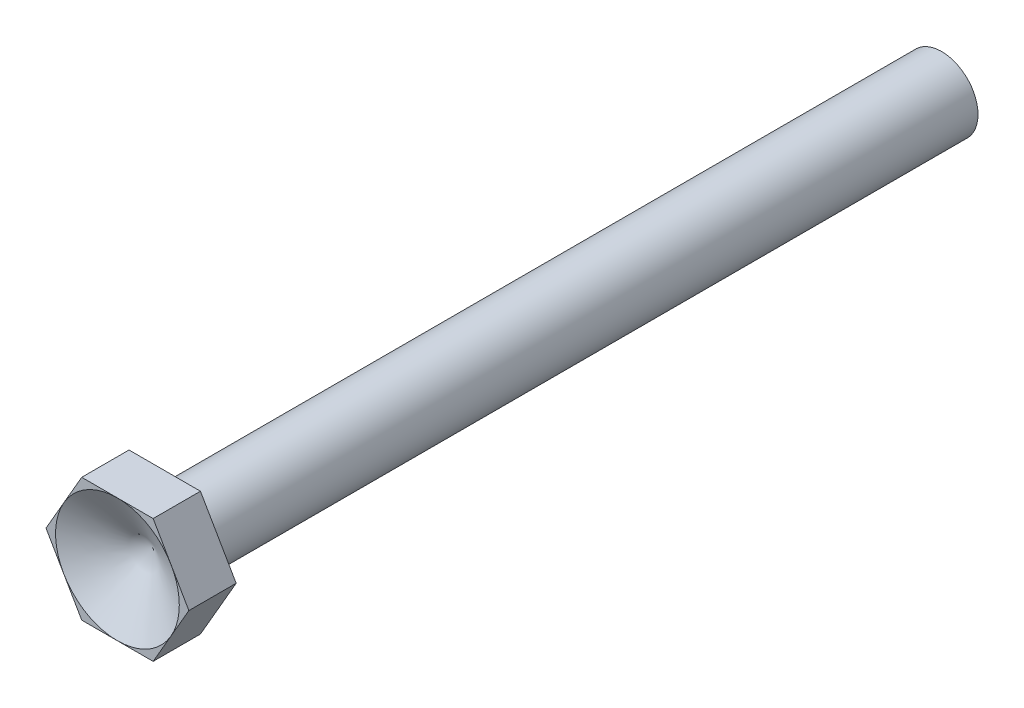
from build123d import *

# Parameters (mm, degrees)
SKETCH1_R           = 10
BOSS_EXTRUDE1_DEPTH = 110
BOSS_EXTRUDE2_DEPTH = 6.5


with BuildPart() as part:
    # Sketch1 → Boss-Extrude1 (new, symmetric)
    with BuildSketch(Plane.XY):
        Circle(SKETCH1_R)
    extrude(amount=BOSS_EXTRUDE1_DEPTH, both=True)

    # Sketch3 → Boss-Extrude2 (add, symmetric)
    with BuildSketch(Plane.XY.offset(110)):
        Polygon((19.629909152, 0), (9.814954576, 17), (-9.814954576, 17), (-19.629909152, 0), (-9.814954576, -17), (9.814954576, -17), align=None)
    extrude(amount=BOSS_EXTRUDE2_DEPTH, both=True)

    # Cut-Extrude1 cone 1 section (through the dimple's axis) → Cut-Extrude1 (revolve, cut)
    with BuildSketch(Plane(origin=(0, 0, 116.5), x_dir=(0, -1, 0), z_dir=(1, 0, 0))):
        Polygon((0, 0), (17, 0), (0, 9.814954576), align=None)
    revolve(axis=Axis((0, 0, 116.5), (0, 0, -1)), mode=Mode.SUBTRACT)


solid = part.part
